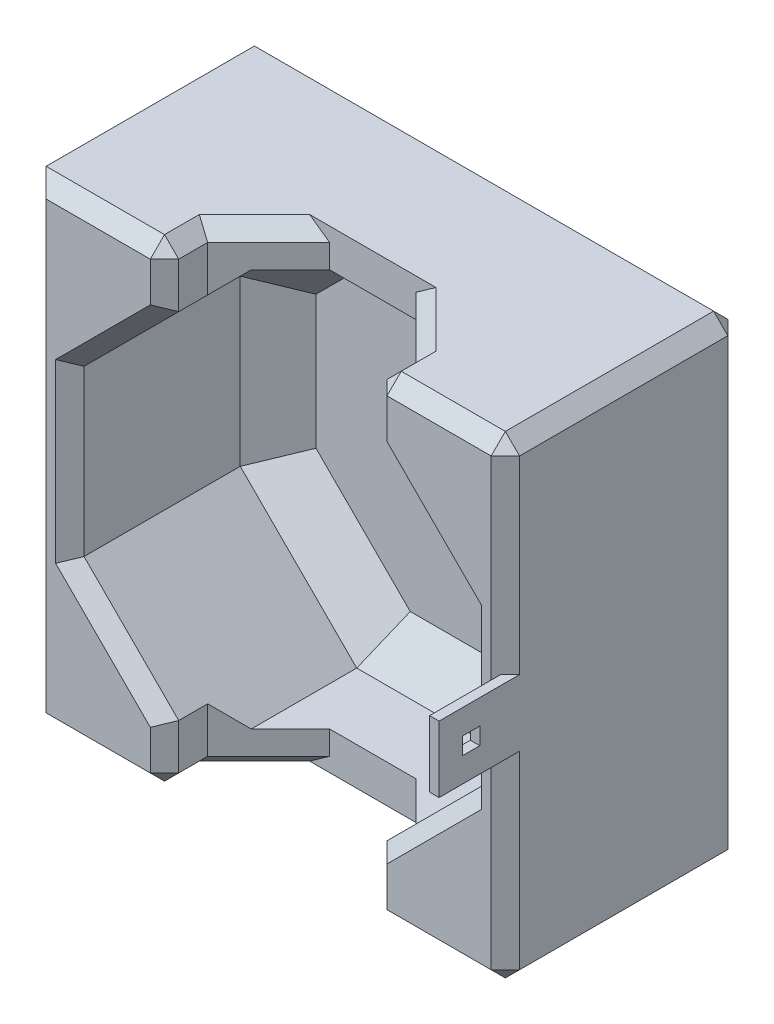
from build123d import *

# Parameters (mm, degrees)
SKETCH1_W                = 50
SKETCH1_H                = 50
BOSS_EXTRUDE1_DEPTH      = 25
CUT_EXTRUDE2_DEPTH       = 76
CUT_EXTRUDE3_DEPTH       = 22
CHAMFER1_SIZE            = 4
CHAMFER2_SIZE            = 1.5
BOSS_EXTRUDE2_DEPTH      = 7
BOSS_EXTRUDE2_DEPTH_BACK = 10
SKETCH6_W                = 1
SKETCH6_H                = 7
SKETCH7_W                = 1.8
SKETCH7_H                = 1.8
CUT_EXTRUDE4_DEPTH       = 78.614431648


with BuildPart() as part:
    # Sketch1 → Boss-Extrude1 (new body)
    with BuildSketch(Plane.XY):
        with Locations((25, 25)):
            Rectangle(SKETCH1_W, SKETCH1_H)
    extrude(amount=BOSS_EXTRUDE1_DEPTH)

    # Sketch3 → Cut-Extrude2 (cut, through all)
    with BuildSketch(Plane.XZ):
        Polygon((36, 29.556349186), (29.556349186, 36), (20.443650814, 36), (14, 29.556349186), (14, 20.443650814), (20.443650814, 14), (29.556349186, 14), (36, 20.443650814), align=None)
    extrude(amount=-CUT_EXTRUDE2_DEPTH, mode=Mode.SUBTRACT)

    # Sketch5 → Cut-Extrude3 (cut)
    with BuildSketch(Plane.XY.offset(25)):
        Polygon((4, 33.69848481), (4, 16.30151519), (16.30151519, 4), (33.69848481, 4), (46, 16.30151519), (46, 33.69848481), (33.69848481, 46), (16.30151519, 46), align=None)
    extrude(amount=-CUT_EXTRUDE3_DEPTH, mode=Mode.SUBTRACT)

    # Chamfer1
    chamfer1_edges = [part.edges().sort_by_distance(p)[0] for p in [
        (39.849242405, 39.849242405, 3),
        (39.849242405, 10.150757595, 3),
        (10.150757595, 39.849242405, 3),
        (25, 46, 3),
        (25, 4, 3),
        (10.150757595, 10.150757595, 3),
        (46, 25, 3),
        (4, 25, 3),
    ]]
    chamfer(chamfer1_edges, length=CHAMFER1_SIZE)

    # Chamfer2
    chamfer2_edges = [part.edges().sort_by_distance(p)[0] for p in [
        (50, 25, 25),
        (43, 50, 25),
        (43, 0, 25),
        (7, 50, 25),
        (14, 3.150757595, 25),
        (36, 46.849242405, 25),
        (36, 50, 22.721825407),
        (14, 50, 22.721825407),
        (36, 0, 22.721825407),
        (14, 0, 22.721825407),
        (17.221825407, 0, 17.221825407),
        (32.778174593, 0, 17.221825407),
        (32.778174593, 50, 17.221825407),
        (17.221825407, 50, 17.221825407),
        (0, 25, 25),
        (25, 50, 0),
        (50, 25, 0),
        (14, 46.849242405, 25),
        (36, 3.150757595, 25),
        (25, 0, 0),
        (41, 38.69848481, 25),
        (41, 11.30151519, 25),
        (46, 25, 25),
        (9, 11.30151519, 25),
        (9, 38.69848481, 25),
        (4, 25, 25),
        (0, 25, 0),
        (7, 0, 25),
        (50, 50, 12.5),
        (50, 0, 12.5),
        (0, 0, 12.5),
    ]]
    chamfer(chamfer2_edges, length=CHAMFER2_SIZE)

    # Sketch6 → Boss-Extrude2 (add, two sides: drawn at the far end of the back side and taken through both)
    with BuildSketch(Plane.XY.offset(25).offset(-BOSS_EXTRUDE2_DEPTH_BACK)):
        with Locations((49.5, 25)):
            Rectangle(SKETCH6_W, SKETCH6_H)
    extrude(amount=BOSS_EXTRUDE2_DEPTH + BOSS_EXTRUDE2_DEPTH_BACK)

    # Sketch7 → Cut-Extrude4 (cut, through all)
    with BuildSketch(Plane(origin=(50, 0, 0), x_dir=(0, 0, -1), z_dir=(1, 0, 0))):
        with Locations((-28.6, 25)):
            Rectangle(SKETCH7_W, SKETCH7_H)
    extrude(amount=-CUT_EXTRUDE4_DEPTH, mode=Mode.SUBTRACT)


solid = part.part
